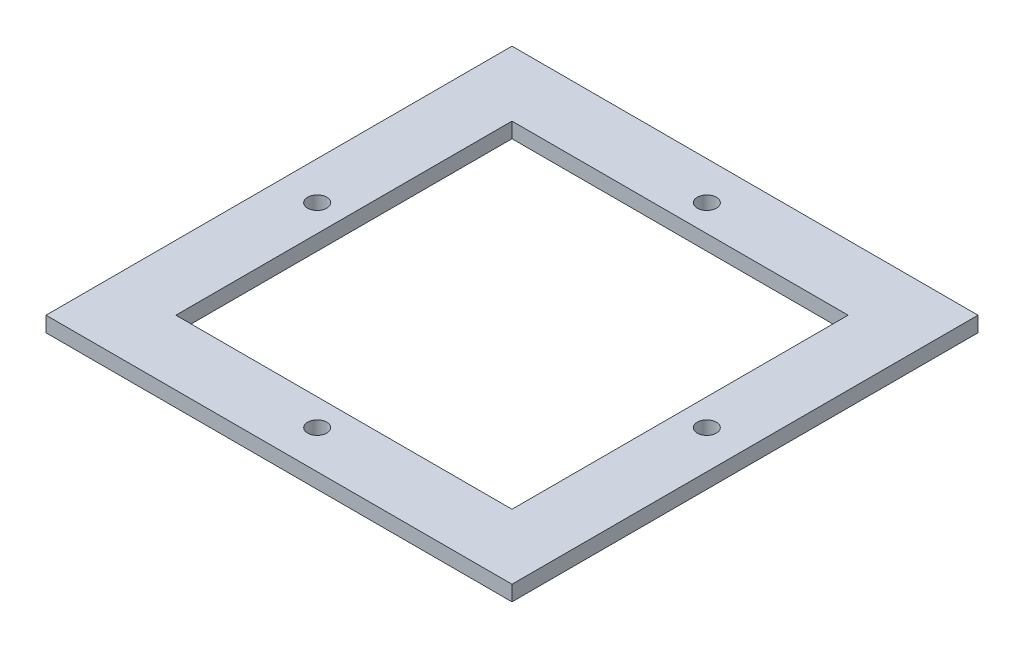
from build123d import *

# Parameters (mm, degrees)
BOSS_EXTRUDE1_DEPTH = 4


with BuildPart() as part:
    # Sketch1 → Boss-Extrude1 (new body)
    with BuildSketch(Plane(origin=(0, 0, 0), x_dir=(1, 0, 0), z_dir=(0, 1, 0))):
        with BuildLine():
            Line((-61, -61), (0, -61))
            Line((0, -61), (0, -53.5))
            ThreePointArc((0, -53.5), (-2.5, -51), (0, -48.5))
            Line((0, -48.5), (0, -44))
            Line((0, -44), (-44, -44))
            Line((-44, -44), (-44, 0))
            Line((-44, 0), (-48.5, 0))
            ThreePointArc((-48.5, 0), (-51, -2.5), (-53.5, 0))
            Line((-53.5, 0), (-61, 0))
            Line((-61, 0), (-61, -61))
        make_face()
        with BuildLine():
            Line((61, 0), (53.5, 0))
            ThreePointArc((53.5, 0), (51, -2.5), (48.5, 0))
            Line((48.5, 0), (44, 0))
            Line((44, 0), (44, -44))
            Line((44, -44), (0, -44))
            Line((0, -44), (0, -48.5))
            ThreePointArc((0, -48.5), (1.767766953, -49.232233047), (2.5, -51))
            ThreePointArc((2.5, -51), (1.767766953, -52.767766953), (0, -53.5))
            Line((0, -53.5), (0, -61))
            Line((0, -61), (61, -61))
            Line((61, -61), (61, 0))
        make_face()
        with BuildLine():
            ThreePointArc((48.5, 0), (51, 2.5), (53.5, 0))
            Line((53.5, 0), (61, 0))
            Line((61, 0), (61, 61))
            Line((61, 61), (0, 61))
            Line((0, 61), (0, 53.5))
            ThreePointArc((0, 53.5), (1.767766953, 52.767766953), (2.5, 51))
            ThreePointArc((2.5, 51), (1.767766953, 49.232233047), (0, 48.5))
            Line((0, 48.5), (0, 44))
            Line((0, 44), (44, 44))
            Line((44, 44), (44, 0))
            Line((44, 0), (48.5, 0))
        make_face()
        with BuildLine():
            Line((0, 53.5), (0, 61))
            Line((0, 61), (-61, 61))
            Line((-61, 61), (-61, 0))
            Line((-61, 0), (-53.5, 0))
            ThreePointArc((-53.5, 0), (-51, 2.5), (-48.5, 0))
            Line((-48.5, 0), (-44, 0))
            Line((-44, 0), (-44, 44))
            Line((-44, 44), (0, 44))
            Line((0, 44), (0, 48.5))
            ThreePointArc((0, 48.5), (-2.5, 51), (0, 53.5))
        make_face()
    extrude(amount=BOSS_EXTRUDE1_DEPTH)


solid = part.part
